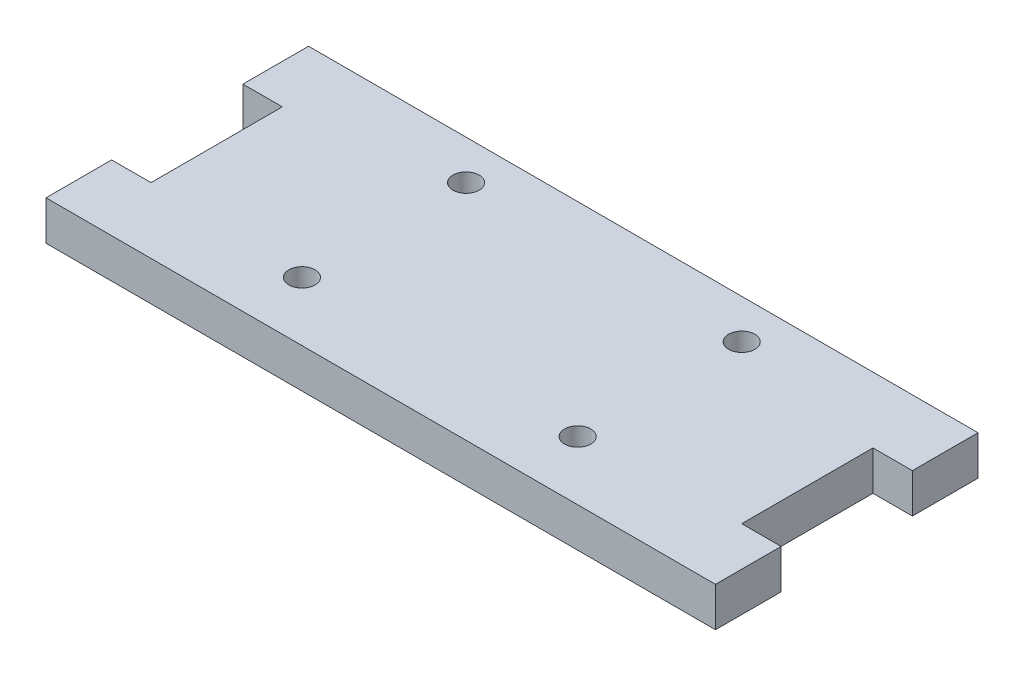
from build123d import *

# Parameters (mm, degrees)
SKETCH1_W           = 3
SKETCH1_H           = 5
SKETCH1_R           = 1
BOSS_EXTRUDE1_DEPTH = 3


with BuildPart() as part:
    # Sketch1 → Boss-Extrude1 (new body)
    # profile 1 of 6: a face of its own
    with BuildSketch(Plane(origin=(0, 0, 0), x_dir=(1, 0, 0), z_dir=(0, 1, 0))):
        with Locations((-1.5, 17.5)):
            Rectangle(SKETCH1_W, SKETCH1_H)
    # profile 2 of 6: a face of its own
    with BuildSketch(Plane(origin=(0, 0, 0), x_dir=(1, 0, 0), z_dir=(0, 1, 0))):
        Polygon((22.5, 0), (22.5, 20), (0, 20), (0, 15), (0, 5), (0, 0), align=None)
        with Locations(Location((12, 4.5, 0), (0, 0, 270))):
            Circle(SKETCH1_R, mode=Mode.SUBTRACT)
        with Locations(Location((12, 17, 0), (0, 0, 270))):
            Circle(SKETCH1_R, mode=Mode.SUBTRACT)
    # profile 3 of 6: a face of its own
    with BuildSketch(Plane(origin=(0, 0, 0), x_dir=(1, 0, 0), z_dir=(0, 1, 0))):
        Polygon((45, 20), (22.5, 20), (22.5, 0), (45, 0), (45, 5), (45, 15), align=None)
        with Locations(Location((33, 4.5, 0), (0, 0, 270))):
            Circle(SKETCH1_R, mode=Mode.SUBTRACT)
        with Locations(Location((33, 17, 0), (0, 0, 270))):
            Circle(SKETCH1_R, mode=Mode.SUBTRACT)
    # profile 4 of 6: a face of its own
    with BuildSketch(Plane(origin=(0, 0, 0), x_dir=(1, 0, 0), z_dir=(0, 1, 0))):
        with Locations((46.5, 17.5)):
            Rectangle(SKETCH1_W, SKETCH1_H)
    # profile 5 of 6: a face of its own
    with BuildSketch(Plane(origin=(0, 0, 0), x_dir=(1, 0, 0), z_dir=(0, 1, 0))):
        with Locations((-1.5, 2.5)):
            Rectangle(SKETCH1_W, SKETCH1_H)
    # profile 6 of 6: a face of its own
    with BuildSketch(Plane(origin=(0, 0, 0), x_dir=(1, 0, 0), z_dir=(0, 1, 0))):
        with Locations((46.5, 2.5)):
            Rectangle(SKETCH1_W, SKETCH1_H)
    extrude(amount=BOSS_EXTRUDE1_DEPTH)


solid = part.part
